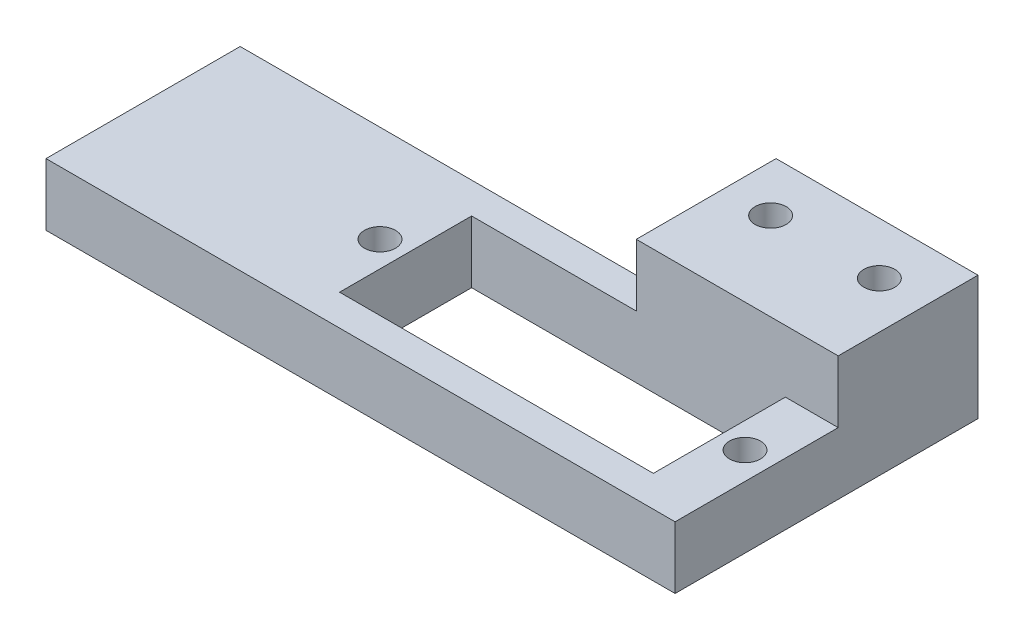
from build123d import *

# Parameters (mm, degrees)
SZKIC1_R                    = 1
SZKIC1_W                    = 20.2
SZKIC1_H                    = 8.5
DODANIE_WYCI_GNI_CIE2_DEPTH = 4
SZKIC3_W                    = 13
SZKIC3_H                    = 9
DODANIE_WYCI_GNI_CIE3_DEPTH = 4
SZKIC1_3_R                  = 1
WYTNIJ_WYCI_GNI_CIE2_DEPTH  = 32.016124839
SZKIC4_R                    = 1
WYTNIJ_WYCI_GNI_CIE3_DEPTH  = 10


with BuildPart() as part:
    # Szkic1 → Dodanie-wyciągnięcie2 (new body)
    with BuildSketch(Plane(origin=(0, 0, 0), x_dir=(1, 0, 0), z_dir=(0, 1, 0))):
        Polygon((-27, -0.5), (0.5, -0.5), (0.5, 6.5), (13.5, 6.5), (13.5, -13), (-27, -13), align=None)
        with Locations((11.75, -6.75)):
            Circle(SZKIC1_R, mode=Mode.SUBTRACT)
        with Locations((-11.75, -6.75)):
            Circle(SZKIC1_R, mode=Mode.SUBTRACT)
        with Locations((3.5, 3.15)):
            Circle(SZKIC1_R, mode=Mode.SUBTRACT)
        with Locations((10.5, 3.15)):
            Circle(SZKIC1_R, mode=Mode.SUBTRACT)
        with Locations((0, -6.75)):
            Rectangle(SZKIC1_W, SZKIC1_H, mode=Mode.SUBTRACT)
    extrude(amount=DODANIE_WYCI_GNI_CIE2_DEPTH)

    # Szkic3 → Dodanie-wyciągnięcie3 (add)
    with BuildSketch(Plane.XZ.offset(-4)):
        with Locations((7, -2)):
            Rectangle(SZKIC3_W, SZKIC3_H)
    extrude(amount=-DODANIE_WYCI_GNI_CIE3_DEPTH)

    # Szkic1<3> → Wytnij-wyciągnięcie2 (cut, through all)
    with BuildSketch(Plane(origin=(0, 0, 0), x_dir=(1, 0, 0), z_dir=(0, 1, 0))):
        with Locations((3.5, 3.15)):
            Circle(SZKIC1_3_R)
        with Locations((10.5, 3.15)):
            Circle(SZKIC1_3_R)
    extrude(amount=WYTNIJ_WYCI_GNI_CIE2_DEPTH, mode=Mode.SUBTRACT)

    # Szkic4 → Wytnij-wyciągnięcie3 (cut)
    with BuildSketch(Plane.ZY.offset(27)):
        with Locations((3.5, 2)):
            Circle(SZKIC4_R)
        with Locations((10, 2)):
            Circle(SZKIC4_R)
    extrude(amount=-WYTNIJ_WYCI_GNI_CIE3_DEPTH, mode=Mode.SUBTRACT)


solid = part.part
